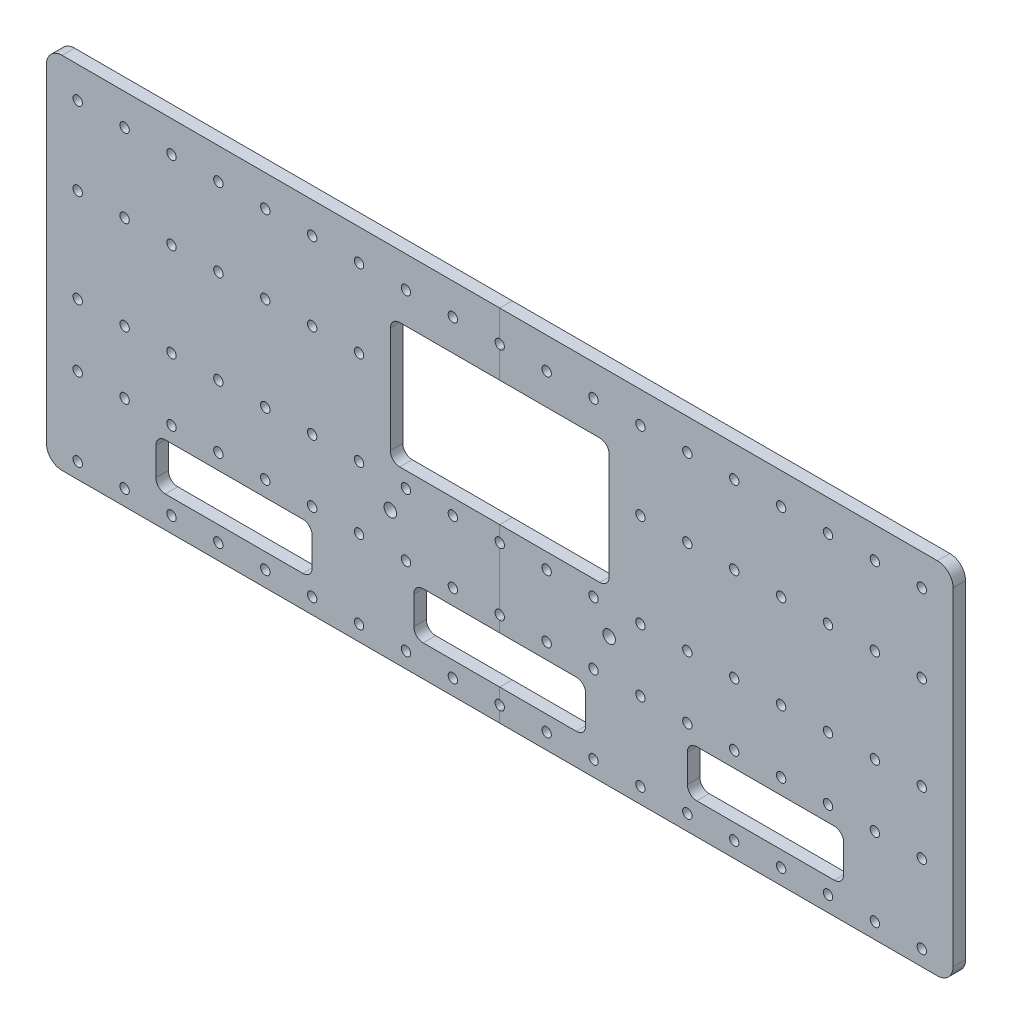
from build123d import *

# Parameters (mm, degrees)
SKETCH_1_W          = 290
SKETCH_1_H          = 115
EXTRUDE_1_DEPTH     = 4
SKETCH_2_R          = 1.5
CUT_EXTRUDE_1_DEPTH = 157.036053526
SKETCH_3_R          = 2
CUT_EXTRUDE_2_DEPTH = 157.036053526
SKETCH_4_W          = 55
SKETCH_4_H          = 15
CUT_EXTRUDE_3_DEPTH = 157.036053526
SKETCH_5_R          = 1.5
CUT_EXTRUDE_4_DEPTH = 157.036053526
FILLET_1_R          = 3
CUT_EXTRUDE_5_DEPTH = 157.036053526
FILLET_2_R          = 5


with BuildPart() as part:
    # 草图1 → 凸台-拉伸1 (new body)
    with BuildSketch(Plane.XY):
        Rectangle(SKETCH_1_W, SKETCH_1_H)
    extrude(amount=EXTRUDE_1_DEPTH)

    # 草图2 → 切除-拉伸1 (cut, through all)
    with BuildSketch(Plane.XY.offset(4)):
        with Locations((-135, 47.5)):
            Circle(SKETCH_2_R)
        with Locations((-120, 47.5)):
            Circle(SKETCH_2_R)
        with Locations((-105, 47.5)):
            Circle(SKETCH_2_R)
        with Locations((-90, 47.5)):
            Circle(SKETCH_2_R)
        with Locations((-75, 47.5)):
            Circle(SKETCH_2_R)
        with Locations((-60, 47.5)):
            Circle(SKETCH_2_R)
        with Locations((-45, 47.5)):
            Circle(SKETCH_2_R)
        with Locations((-30, 47.5)):
            Circle(SKETCH_2_R)
        with Locations((-15, 47.5)):
            Circle(SKETCH_2_R)
        with Locations((0, 47.5)):
            Circle(SKETCH_2_R)
        with Locations((15, 47.5)):
            Circle(SKETCH_2_R)
        with Locations((30, 47.5)):
            Circle(SKETCH_2_R)
        with Locations((45, 47.5)):
            Circle(SKETCH_2_R)
        with Locations((60, 47.5)):
            Circle(SKETCH_2_R)
        with Locations((75, 47.5)):
            Circle(SKETCH_2_R)
        with Locations((90, 47.5)):
            Circle(SKETCH_2_R)
        with Locations((105, 47.5)):
            Circle(SKETCH_2_R)
        with Locations((120, 47.5)):
            Circle(SKETCH_2_R)
        with Locations((135, 47.5)):
            Circle(SKETCH_2_R)
        with Locations((-135, -27.5)):
            Circle(SKETCH_2_R)
        with Locations((-120, -27.5)):
            Circle(SKETCH_2_R)
        with Locations((-105, -27.5)):
            Circle(SKETCH_2_R)
        with Locations((-90, -27.5)):
            Circle(SKETCH_2_R)
        with Locations((-75, -27.5)):
            Circle(SKETCH_2_R)
        with Locations((-60, -27.5)):
            Circle(SKETCH_2_R)
        with Locations((-45, -27.5)):
            Circle(SKETCH_2_R)
        with Locations((-30, -27.5)):
            Circle(SKETCH_2_R)
        with Locations((-15, -27.5)):
            Circle(SKETCH_2_R)
        with Locations((0, -27.5)):
            Circle(SKETCH_2_R)
        with Locations((15, -27.5)):
            Circle(SKETCH_2_R)
        with Locations((30, -27.5)):
            Circle(SKETCH_2_R)
        with Locations((45, -27.5)):
            Circle(SKETCH_2_R)
        with Locations((60, -27.5)):
            Circle(SKETCH_2_R)
        with Locations((75, -27.5)):
            Circle(SKETCH_2_R)
        with Locations((90, -27.5)):
            Circle(SKETCH_2_R)
        with Locations((105, -27.5)):
            Circle(SKETCH_2_R)
        with Locations((120, -27.5)):
            Circle(SKETCH_2_R)
        with Locations((135, -27.5)):
            Circle(SKETCH_2_R)
        with Locations(Location((135, -52.5, 0), (0, 0, 180))):
            Circle(SKETCH_2_R)
        with Locations(Location((120, -52.5, 0), (0, 0, 180))):
            Circle(SKETCH_2_R)
        with Locations(Location((105, -52.5, 0), (0, 0, 180))):
            Circle(SKETCH_2_R)
        with Locations(Location((90, -52.5, 0), (0, 0, 180))):
            Circle(SKETCH_2_R)
        with Locations(Location((75, -52.5, 0), (0, 0, 180))):
            Circle(SKETCH_2_R)
        with Locations(Location((60, -52.5, 0), (0, 0, 180))):
            Circle(SKETCH_2_R)
        with Locations(Location((45, -52.5, 0), (0, 0, 180))):
            Circle(SKETCH_2_R)
        with Locations(Location((30, -52.5, 0), (0, 0, 180))):
            Circle(SKETCH_2_R)
        with Locations(Location((15, -52.5, 0), (0, 0, 180))):
            Circle(SKETCH_2_R)
        with Locations(Location((0, -52.5, 0), (0, 0, 180))):
            Circle(SKETCH_2_R)
        with Locations(Location((-15, -52.5, 0), (0, 0, 180))):
            Circle(SKETCH_2_R)
        with Locations(Location((-30, -52.5, 0), (0, 0, 180))):
            Circle(SKETCH_2_R)
        with Locations(Location((-45, -52.5, 0), (0, 0, 180))):
            Circle(SKETCH_2_R)
        with Locations(Location((-60, -52.5, 0), (0, 0, 180))):
            Circle(SKETCH_2_R)
        with Locations(Location((-75, -52.5, 0), (0, 0, 180))):
            Circle(SKETCH_2_R)
        with Locations(Location((-90, -52.5, 0), (0, 0, 180))):
            Circle(SKETCH_2_R)
        with Locations(Location((-105, -52.5, 0), (0, 0, 180))):
            Circle(SKETCH_2_R)
        with Locations(Location((-120, -52.5, 0), (0, 0, 180))):
            Circle(SKETCH_2_R)
        with Locations(Location((-135, -52.5, 0), (0, 0, 180))):
            Circle(SKETCH_2_R)
    extrude(amount=-CUT_EXTRUDE_1_DEPTH, mode=Mode.SUBTRACT)

    # 草图3 → 切除-拉伸2 (cut, through all)
    with BuildSketch(Plane.XY.offset(4)):
        with Locations((-35, -16)):
            Circle(SKETCH_3_R)
        with Locations(Location((35, -16, 0), (0, 0, 180))):
            Circle(SKETCH_3_R)
    extrude(amount=-CUT_EXTRUDE_2_DEPTH, mode=Mode.SUBTRACT)

    # 草图4 → 切除-拉伸3 (cut, through all)
    with BuildSketch(Plane.XY.offset(4)):
        with Locations((0, -40)):
            Rectangle(SKETCH_4_W, SKETCH_4_H)
    extrude(amount=-CUT_EXTRUDE_3_DEPTH, mode=Mode.SUBTRACT)

    # 草图5 → 切除-拉伸4 (cut, through all)
    with BuildSketch(Plane.XY.offset(4)):
        with Locations((-135, -7.5)):
            Circle(SKETCH_5_R)
        with Locations((-120, -7.5)):
            Circle(SKETCH_5_R)
        with Locations((-105, -7.5)):
            Circle(SKETCH_5_R)
        with Locations((-90, -7.5)):
            Circle(SKETCH_5_R)
        with Locations((-75, -7.5)):
            Circle(SKETCH_5_R)
        with Locations((-60, -7.5)):
            Circle(SKETCH_5_R)
        with Locations((-45, -7.5)):
            Circle(SKETCH_5_R)
        with Locations((-30, -7.5)):
            Circle(SKETCH_5_R)
        with Locations((-15, -7.5)):
            Circle(SKETCH_5_R)
        with Locations((0, -7.5)):
            Circle(SKETCH_5_R)
        with Locations((15, -7.5)):
            Circle(SKETCH_5_R)
        with Locations((30, -7.5)):
            Circle(SKETCH_5_R)
        with Locations((45, -7.5)):
            Circle(SKETCH_5_R)
        with Locations((60, -7.5)):
            Circle(SKETCH_5_R)
        with Locations((75, -7.5)):
            Circle(SKETCH_5_R)
        with Locations((90, -7.5)):
            Circle(SKETCH_5_R)
        with Locations((105, -7.5)):
            Circle(SKETCH_5_R)
        with Locations((120, -7.5)):
            Circle(SKETCH_5_R)
        with Locations((135, -7.5)):
            Circle(SKETCH_5_R)
        with Locations((150, -7.5)):
            Circle(SKETCH_5_R)
        with Locations((-120, 22.5)):
            Circle(SKETCH_5_R)
        with Locations((-105, 22.5)):
            Circle(SKETCH_5_R)
        with Locations((-90, 22.5)):
            Circle(SKETCH_5_R)
        with Locations((-75, 22.5)):
            Circle(SKETCH_5_R)
        with Locations((-60, 22.5)):
            Circle(SKETCH_5_R)
        with Locations((-45, 22.5)):
            Circle(SKETCH_5_R)
        with Locations((-30, 22.5)):
            Circle(SKETCH_5_R)
        with Locations((-15, 22.5)):
            Circle(SKETCH_5_R)
        with Locations((0, 22.5)):
            Circle(SKETCH_5_R)
        with Locations((15, 22.5)):
            Circle(SKETCH_5_R)
        with Locations((30, 22.5)):
            Circle(SKETCH_5_R)
        with Locations((45, 22.5)):
            Circle(SKETCH_5_R)
        with Locations((60, 22.5)):
            Circle(SKETCH_5_R)
        with Locations((75, 22.5)):
            Circle(SKETCH_5_R)
        with Locations((90, 22.5)):
            Circle(SKETCH_5_R)
        with Locations((105, 22.5)):
            Circle(SKETCH_5_R)
        with Locations((120, 22.5)):
            Circle(SKETCH_5_R)
        with Locations((135, 22.5)):
            Circle(SKETCH_5_R)
        with Locations((150, 22.5)):
            Circle(SKETCH_5_R)
        with Locations((-135, 22.5)):
            Circle(SKETCH_5_R)
    extrude(amount=-CUT_EXTRUDE_4_DEPTH, mode=Mode.SUBTRACT)

    # 圆角1
    fillet_1_edges = [part.edges().sort_by_distance(p)[0] for p in [
        (27.5, -32.5, 2),
        (27.5, -47.5, 2),
        (-27.5, -47.5, 2),
        (-27.5, -32.5, 2),
    ]]
    fillet(fillet_1_edges, radius=FILLET_1_R)

    # 草图6 → 切除-拉伸5 (cut, through all)
    with BuildSketch(Plane.XY.offset(4)):
        with BuildLine():
            Line((-32, 37.5), (32, 37.5))
            ThreePointArc((32, 37.5), (34.121320344, 36.621320344), (35, 34.5))
            Line((35, 34.5), (35, 0.5))
            ThreePointArc((35, 0.5), (34.121320344, -1.621320344), (32, -2.5))
            Line((32, -2.5), (-32, -2.5))
            ThreePointArc((-32, -2.5), (-34.121320344, -1.621320344), (-35, 0.5))
            Line((-35, 0.5), (-35, 34.5))
            ThreePointArc((-35, 34.5), (-34.121320344, 36.621320344), (-32, 37.5))
        make_face()
        with BuildLine():
            Line((-107, -32.5), (-63, -32.5))
            ThreePointArc((-63, -32.5), (-60.878679656, -33.378679656), (-60, -35.5))
            Line((-60, -35.5), (-60, -44.5))
            ThreePointArc((-60, -44.5), (-60.878679656, -46.621320344), (-63, -47.5))
            Line((-63, -47.5), (-107, -47.5))
            ThreePointArc((-107, -47.5), (-109.121320344, -46.621320344), (-110, -44.5))
            Line((-110, -44.5), (-110, -35.5))
            ThreePointArc((-110, -35.5), (-109.121320344, -33.378679656), (-107, -32.5))
        make_face()
        with BuildLine():
            Line((107, -47.5), (63, -47.5))
            ThreePointArc((63, -47.5), (60.878679656, -46.621320344), (60, -44.5))
            Line((60, -44.5), (60, -35.5))
            ThreePointArc((60, -35.5), (60.878679656, -33.378679656), (63, -32.5))
            Line((63, -32.5), (107, -32.5))
            ThreePointArc((107, -32.5), (109.121320344, -33.378679656), (110, -35.5))
            Line((110, -35.5), (110, -44.5))
            ThreePointArc((110, -44.5), (109.121320344, -46.621320344), (107, -47.5))
        make_face()
    extrude(amount=-CUT_EXTRUDE_5_DEPTH, mode=Mode.SUBTRACT)

    # 圆角2
    fillet_2_edges = [part.edges().sort_by_distance(p)[0] for p in [
        (145, -57.5, 2),
        (-145, -57.5, 2),
        (-145, 57.5, 2),
        (145, 57.5, 2),
    ]]
    fillet(fillet_2_edges, radius=FILLET_2_R)


with BuildPart() as body_2:
    # Split Bodies 1: the piece on the far side of the plane
    add(part.part)
    split(bisect_by=Plane(origin=(0, 0, 0), x_dir=(0, -1, 0), z_dir=(-1, 0, 0)), keep=Keep.BOTTOM)


with BuildPart() as part_1:
    add(part.part)

    # Split Bodies 1
    split(bisect_by=Plane(origin=(0, 0, 0), x_dir=(0, -1, 0), z_dir=(-1, 0, 0)), keep=Keep.TOP)


solid = Compound([body_2.part, part_1.part])
